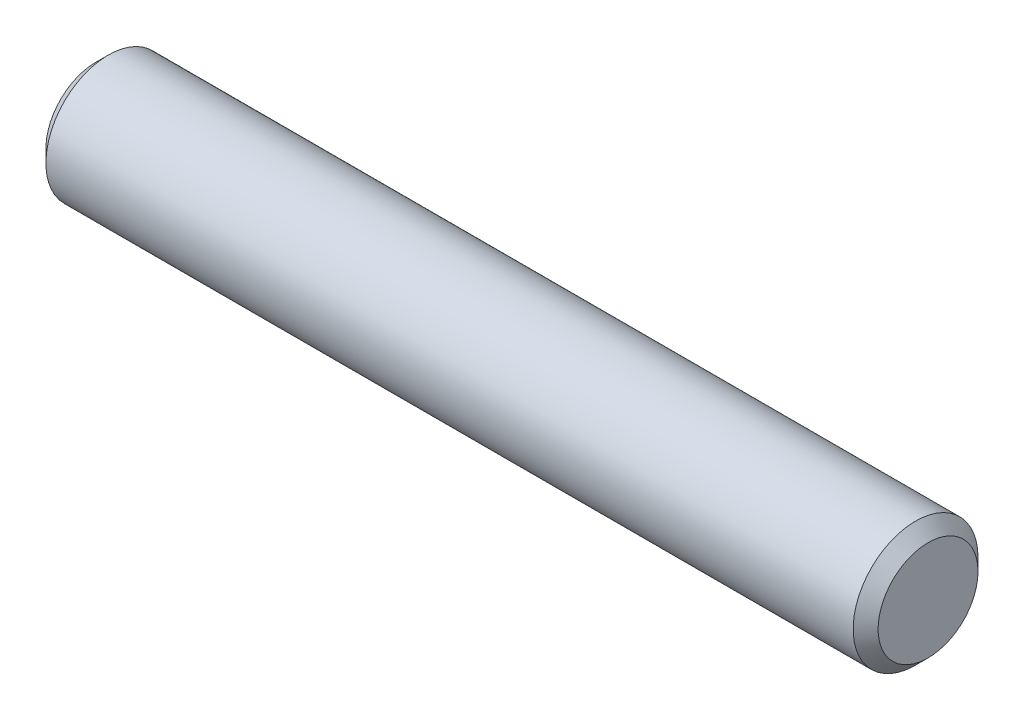
from build123d import *

# Parameters (mm, degrees)
EXTRUDE1_DEPTH      = 15.875
EXTRUDE1_DEPTH_BACK = 15.875
SKETCH2_R           = 2.38125
CHAMFER1_SIZE       = 0.47625


with BuildPart() as part:
    # Sketch2 → Extrude1 (new, two sides: drawn at the far end of the back side and taken through both)
    with BuildSketch(Plane(origin=(0, 0, 0), x_dir=(0, 0, -1), z_dir=(1, 0, 0)).offset(-EXTRUDE1_DEPTH_BACK)):
        Circle(SKETCH2_R)
    extrude(amount=EXTRUDE1_DEPTH + EXTRUDE1_DEPTH_BACK)

    # Chamfer1
    chamfer1_edges = [part.edges().sort_by_distance(p)[0] for p in [
        (-15.875, 0, 2.38125),
        (15.875, 0, 2.38125),
    ]]
    chamfer(chamfer1_edges, length=CHAMFER1_SIZE)


solid = part.part
